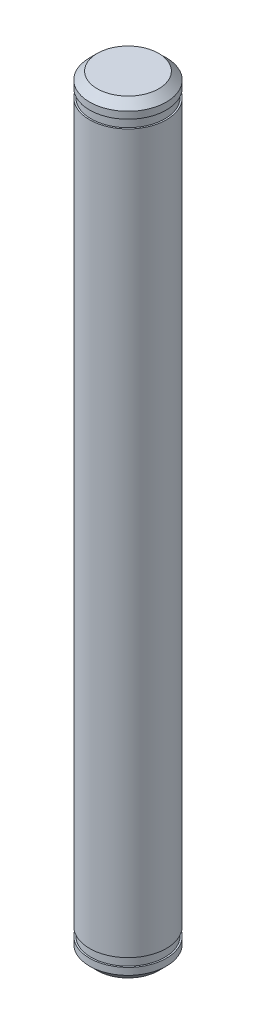
from build123d import *

# Parameters (mm, degrees)
CHAMFER_1_SIZE      = 1
CUT_EXTRUDE_START   = -3
SKETCH_2_R          = 5
SKETCH_2_R_2        = 4.8
CUT_EXTRUDE_1_DEPTH = 1.1


with BuildPart() as part:
    # 草图1 → 旋转1 (revolve)
    with BuildSketch(Plane.XY, mode=Mode.PRIVATE) as revolve_1_sk:
        Polygon((0, 40), (5, 40), (5, 30), (5, -49.5), (5, -59.5), (0, -59.5), align=None)
    revolve(revolve_1_sk.sketch.rotate(Axis((0, 40, 0), (0, -1, 0)), 180), axis=Axis((0, 40, 0), (0, -1, 0)))

    # 倒角1
    chamfer_1_edges = [part.edges().sort_by_distance(p)[0] for p in [
        (5, -59.5, 0),
        (5, 40, 0),
    ]]
    chamfer(chamfer_1_edges, length=CHAMFER_1_SIZE)

    # 草图2 → 切除-拉伸1 (cut)
    with BuildSketch(Plane(origin=(0, 40, 0), x_dir=(1, 0, 0), z_dir=(0, 1, 0)).offset(CUT_EXTRUDE_START)):
        with Locations(Location((0, 0, 0), (0, 0, 180))):
            Circle(SKETCH_2_R)
        with Locations(Location((0, 0, 0), (0, 0, 180))):
            Circle(SKETCH_2_R_2, mode=Mode.SUBTRACT)
    cut_extrude_1 = extrude(amount=CUT_EXTRUDE_1_DEPTH, mode=Mode.SUBTRACT)

    # 镜向1: 切除-拉伸1 across plane
    add(cut_extrude_1.mirror(Plane.ZX.offset(-9.75)), mode=Mode.SUBTRACT)


solid = part.part
